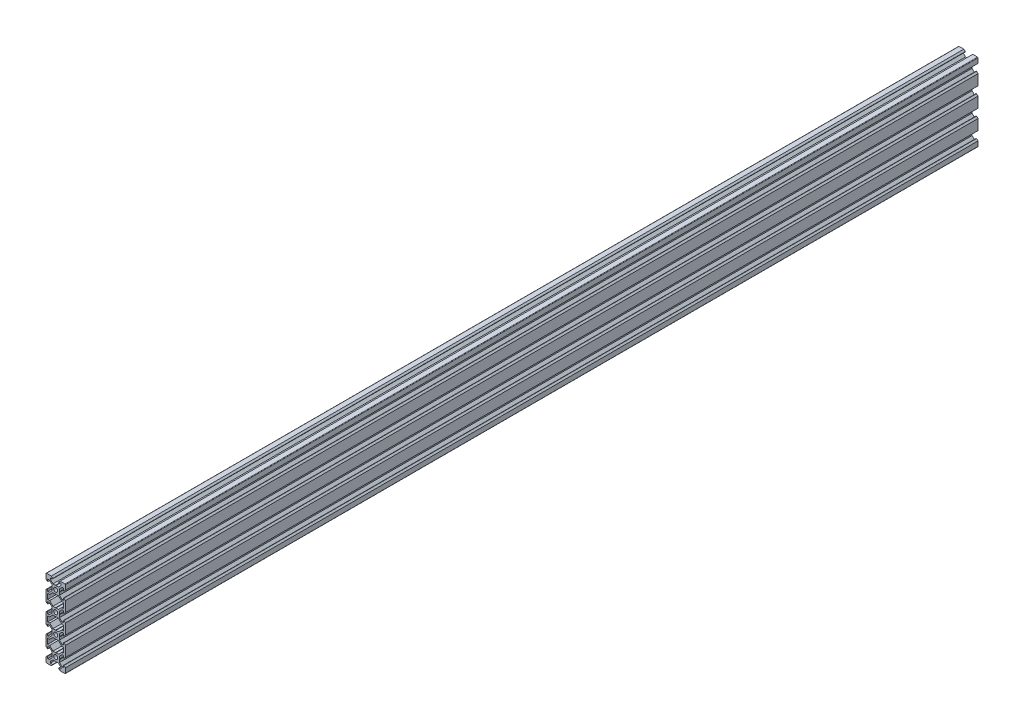
from build123d import *

# Parameters (mm, degrees)
BOSS_EXTRU_1_DEPTH = 940


with BuildPart() as part:
    # Esquisse1 → Boss.-Extru.1 (new body)
    with BuildSketch(Plane.XY):
        with BuildLine():
            Line((-9.5, 10), (-4.58, 10))
            Line((-4.58, 10), (-3.125, 8.545))
            Line((-3.125, 8.545), (-3.125, 8.2))
            Line((-3.125, 8.2), (-5.5, 8.2))
            Line((-5.5, 8.2), (-5.5, 6.560660172))
            Line((-5.5, 6.560660172), (-2.839339828, 3.9))
            Line((-2.839339828, 3.9), (-0.21, 3.9))
            Line((-0.21, 3.9), (0, 3.69))
            Line((0, 3.69), (0, 2.1))
            ThreePointArc((0, 2.1), (-2.1, 0), (0, -2.1))
            Line((0, -2.1), (0, -3.69))
            Line((0, -3.69), (-0.21, -3.9))
            Line((-0.21, -3.9), (-2.839339828, -3.9))
            Line((-2.839339828, -3.9), (-6.239339828, -7.3))
            Line((-6.239339828, -7.3), (-8.2, -7.3))
            Line((-8.2, -7.3), (-8.2, -12.7))
            Line((-8.2, -12.7), (-6.239339828, -12.7))
            Line((-6.239339828, -12.7), (-2.839339828, -16.1))
            Line((-2.839339828, -16.1), (-0.21, -16.1))
            Line((-0.21, -16.1), (0, -16.31))
            Line((0, -16.31), (0, -17.9))
            ThreePointArc((0, -17.9), (-2.1, -20), (0, -22.1))
            Line((0, -22.1), (0, -23.69))
            Line((0, -23.69), (-0.21, -23.9))
            Line((-0.21, -23.9), (-2.839339828, -23.9))
            Line((-2.839339828, -23.9), (-6.239339828, -27.3))
            Line((-6.239339828, -27.3), (-8.2, -27.3))
            Line((-8.2, -27.3), (-8.2, -32.7))
            Line((-8.2, -32.7), (-6.239339828, -32.7))
            Line((-6.239339828, -32.7), (-2.839339828, -36.1))
            Line((-2.839339828, -36.1), (-0.21, -36.1))
            Line((-0.21, -36.1), (0, -36.31))
            Line((0, -36.31), (0, -37.9))
            ThreePointArc((0, -37.9), (-2.1, -40), (0, -42.1))
            Line((0, -42.1), (0, -43.69))
            Line((0, -43.69), (-0.21, -43.9))
            Line((-0.21, -43.9), (-2.839339828, -43.9))
            Line((-2.839339828, -43.9), (-6.239339828, -47.3))
            Line((-6.239339828, -47.3), (-8.2, -47.3))
            Line((-8.2, -47.3), (-8.2, -52.7))
            Line((-8.2, -52.7), (-6.239339828, -52.7))
            Line((-6.239339828, -52.7), (-2.839339828, -56.1))
            Line((-2.839339828, -56.1), (-0.21, -56.1))
            Line((-0.21, -56.1), (0, -56.31))
            Line((0, -56.31), (0, -57.9))
            ThreePointArc((0, -57.9), (-2.1, -60), (0, -62.1))
            Line((0, -62.1), (0, -63.69))
            Line((0, -63.69), (-0.21, -63.9))
            Line((-0.21, -63.9), (-2.839339828, -63.9))
            Line((-2.839339828, -63.9), (-5.5, -66.560660172))
            Line((-5.5, -66.560660172), (-5.5, -68.2))
            Line((-5.5, -68.2), (-3.125, -68.2))
            Line((-3.125, -68.2), (-3.125, -68.545))
            Line((-3.125, -68.545), (-4.58, -70))
            Line((-4.58, -70), (-9.5, -70))
            ThreePointArc((-9.5, -70), (-9.853553391, -69.853553391), (-10, -69.5))
            Line((-10, -69.5), (-10, -64.58))
            Line((-10, -64.58), (-8.545, -63.125))
            Line((-8.545, -63.125), (-8.2, -63.125))
            Line((-8.2, -63.125), (-8.2, -65.5))
            Line((-8.2, -65.5), (-6.560660172, -65.5))
            Line((-6.560660172, -65.5), (-3.9, -62.839339828))
            Line((-3.9, -62.839339828), (-3.9, -60.21))
            Line((-3.9, -60.21), (-3.69, -60))
            Line((-3.69, -60), (-3.9, -59.79))
            Line((-3.9, -59.79), (-3.9, -57.160660172))
            Line((-3.9, -57.160660172), (-6.560660172, -54.5))
            Line((-6.560660172, -54.5), (-8.2, -54.5))
            Line((-8.2, -54.5), (-8.2, -56.875))
            Line((-8.2, -56.875), (-8.545, -56.875))
            Line((-8.545, -56.875), (-10, -55.42))
            Line((-10, -55.42), (-10, -44.58))
            Line((-10, -44.58), (-8.545, -43.125))
            Line((-8.545, -43.125), (-8.2, -43.125))
            Line((-8.2, -43.125), (-8.2, -45.5))
            Line((-8.2, -45.5), (-6.560660172, -45.5))
            Line((-6.560660172, -45.5), (-3.9, -42.839339828))
            Line((-3.9, -42.839339828), (-3.9, -40.21))
            Line((-3.9, -40.21), (-3.69, -40))
            Line((-3.69, -40), (-3.9, -39.79))
            Line((-3.9, -39.79), (-3.9, -37.160660172))
            Line((-3.9, -37.160660172), (-6.560660172, -34.5))
            Line((-6.560660172, -34.5), (-8.2, -34.5))
            Line((-8.2, -34.5), (-8.2, -36.875))
            Line((-8.2, -36.875), (-8.545, -36.875))
            Line((-8.545, -36.875), (-10, -35.42))
            Line((-10, -35.42), (-10, -24.58))
            Line((-10, -24.58), (-8.545, -23.125))
            Line((-8.545, -23.125), (-8.2, -23.125))
            Line((-8.2, -23.125), (-8.2, -25.5))
            Line((-8.2, -25.5), (-6.560660172, -25.5))
            Line((-6.560660172, -25.5), (-3.9, -22.839339828))
            Line((-3.9, -22.839339828), (-3.9, -20.21))
            Line((-3.9, -20.21), (-3.69, -20))
            Line((-3.69, -20), (-3.9, -19.79))
            Line((-3.9, -19.79), (-3.9, -17.160660172))
            Line((-3.9, -17.160660172), (-6.560660172, -14.5))
            Line((-6.560660172, -14.5), (-8.2, -14.5))
            Line((-8.2, -14.5), (-8.2, -16.875))
            Line((-8.2, -16.875), (-8.545, -16.875))
            Line((-8.545, -16.875), (-10, -15.42))
            Line((-10, -15.42), (-10, -4.58))
            Line((-10, -4.58), (-8.545, -3.125))
            Line((-8.545, -3.125), (-8.2, -3.125))
            Line((-8.2, -3.125), (-8.2, -5.5))
            Line((-8.2, -5.5), (-6.560660172, -5.5))
            Line((-6.560660172, -5.5), (-3.9, -2.839339828))
            Line((-3.9, -2.839339828), (-3.9, -0.21))
            Line((-3.9, -0.21), (-3.69, 0))
            Line((-3.69, 0), (-3.9, 0.21))
            Line((-3.9, 0.21), (-3.9, 2.839339828))
            Line((-3.9, 2.839339828), (-6.560660172, 5.5))
            Line((-6.560660172, 5.5), (-8.2, 5.5))
            Line((-8.2, 5.5), (-8.2, 3.125))
            Line((-8.2, 3.125), (-8.545, 3.125))
            Line((-8.545, 3.125), (-10, 4.58))
            Line((-10, 4.58), (-10, 9.5))
            ThreePointArc((-10, 9.5), (-9.853553391, 9.853553391), (-9.5, 10))
        make_face()
    boss_extru_1 = extrude(amount=BOSS_EXTRU_1_DEPTH)

    # Symétrie1: Boss.-Extru.1 across Right Plane
    add(boss_extru_1.mirror(Plane(origin=(0, 0, 0), x_dir=(0, 0, -1), z_dir=(1, 0, 0))))


solid = part.part
